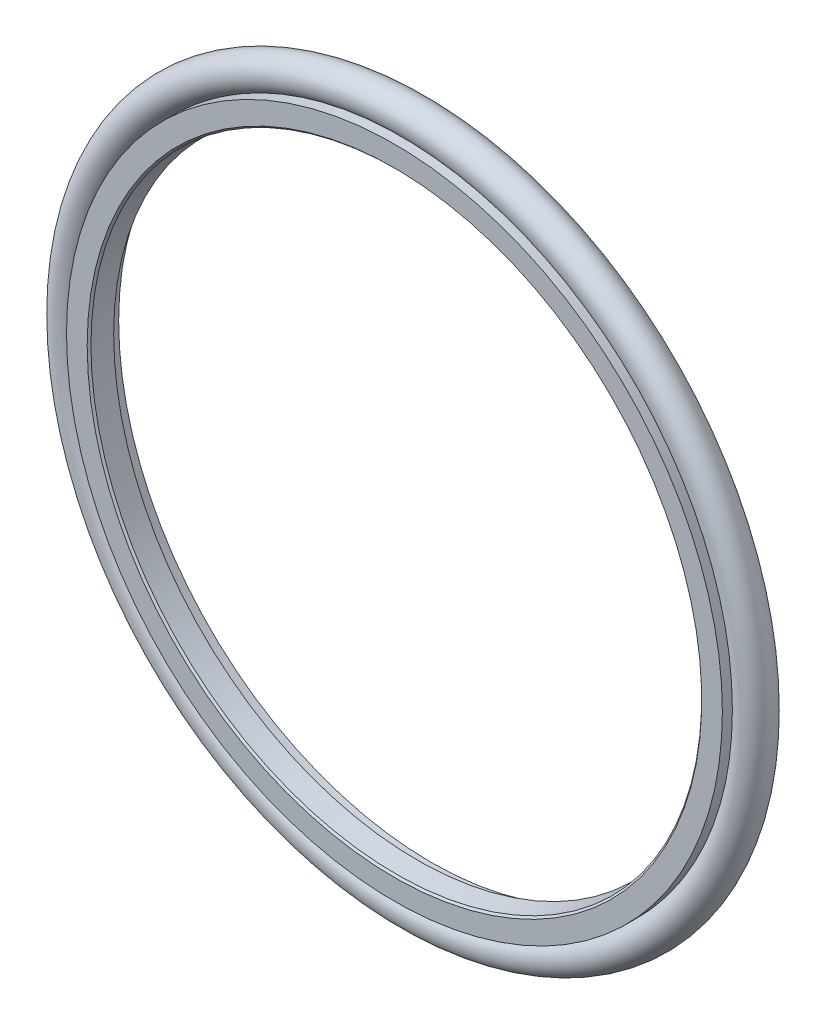
from build123d import *

# Parameters (mm, degrees)
SKETCH4_R = 1.765


with BuildPart() as part:
    # Sketch1 → Revolve1 (revolve)
    with BuildSketch(Plane(origin=(0, 0, 0), x_dir=(0, 0, -1), z_dir=(1, 0, 0))):
        Polygon((0, 33.3), (0, 34.9), (-3.95, 34.9), (-3.95, 32.7), (-3.75, 32.5), (-1.5, 32.33), (-0.9, 33.3), align=None)
    revolve(axis=Axis((0, 0, 0), (0, 0, 1)))


with BuildPart() as body_2:
    # Sketch4 → Revolve2 (revolve)
    with BuildSketch(Plane(origin=(0, 0, 0), x_dir=(0, 0, -1), z_dir=(1, 0, 0))):
        with Locations((-1.975, 36.485)):
            Circle(SKETCH4_R)
    revolve(axis=Axis((0, 0, 0), (0, 0, 1)))


solid = Compound([part.part, body_2.part])
